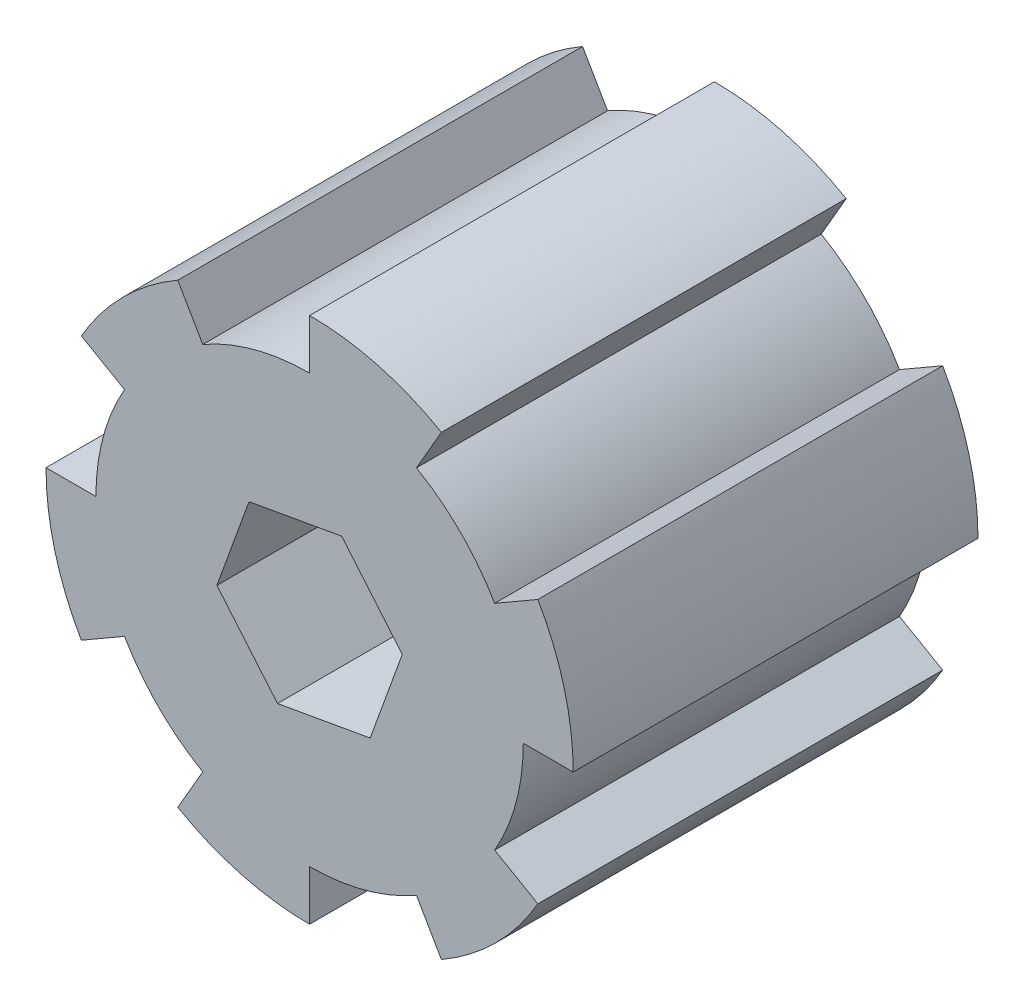
from build123d import *

# Parameters (mm, degrees)
DODANIE_WYCI_GNI_CIE1_DEPTH = 21.5


with BuildPart() as part:
    # Szkic1 → Dodanie-wyciągnięcie1 (new body)
    with BuildSketch(Plane.XY):
        with BuildLine():
            Line((0, 14), (0, 11.35))
            ThreePointArc((0, 11.35), (-2.937596162, 10.963258128), (-5.675, 9.829388333))
            Line((-5.675, 9.829388333), (-7, 12.124355653))
            ThreePointArc((-7, 12.124355653), (-9.899494937, 9.899494937), (-12.124355653, 7))
            Line((-12.124355653, 7), (-9.829388333, 5.675))
            ThreePointArc((-9.829388333, 5.675), (-10.963258128, 2.937596162), (-11.35, 0))
            Line((-11.35, 0), (-14, 0))
            ThreePointArc((-14, 0), (-13.522961568, -3.623466631), (-12.124355653, -7))
            Line((-12.124355653, -7), (-9.829388333, -5.675))
            ThreePointArc((-9.829388333, -5.675), (-8.025661966, -8.025661966), (-5.675, -9.829388333))
            Line((-5.675, -9.829388333), (-7, -12.124355653))
            ThreePointArc((-7, -12.124355653), (-3.623466631, -13.522961568), (0, -14))
            Line((0, -14), (0, -11.35))
            ThreePointArc((0, -11.35), (2.937596162, -10.963258128), (5.675, -9.829388333))
            Line((5.675, -9.829388333), (7, -12.124355653))
            ThreePointArc((7, -12.124355653), (9.899494937, -9.899494937), (12.124355653, -7))
            Line((12.124355653, -7), (9.829388333, -5.675))
            ThreePointArc((9.829388333, -5.675), (10.963258128, -2.937596162), (11.35, 0))
            Line((11.35, 0), (14, 0))
            ThreePointArc((14, 0), (13.522961568, 3.623466631), (12.124355653, 7))
            Line((12.124355653, 7), (9.829388333, 5.675))
            ThreePointArc((9.829388333, 5.675), (8.025661966, 8.025661966), (5.675, 9.829388333))
            Line((5.675, 9.829388333), (7, 12.124355653))
            ThreePointArc((7, 12.124355653), (3.623466631, 13.522961568), (0, 14))
        make_face()
        Polygon((4.922995461, 0.874137115), (1.704472782, 4.700507689), (-3.218522678, 3.826370574), (-4.922995461, -0.874137115), (-1.704472782, -4.700507689), (3.218522678, -3.826370574), align=None, mode=Mode.SUBTRACT)
    extrude(amount=DODANIE_WYCI_GNI_CIE1_DEPTH)


solid = part.part
